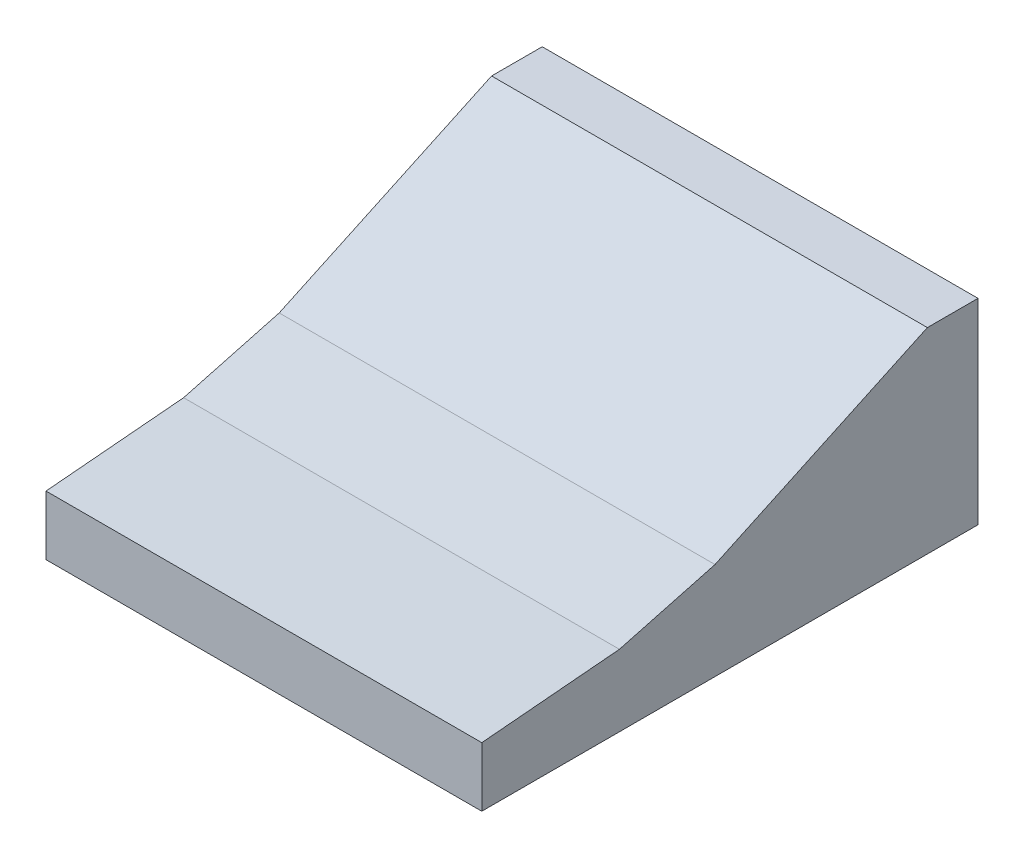
from build123d import *

# Parameters (mm, degrees)
AUFSATZ_LINEAR_AUSTRAGEN1_DEPTH = 440


with BuildPart() as part:
    # Skizze1 → Aufsatz-Linear austragen1 (new body)
    with BuildSketch(Plane(origin=(0, 0, 0), x_dir=(0, 0, -1), z_dir=(1, 0, 0))):
        Polygon((138.961378968, 72.157545328), (235.457769952, 98.013675364), (449.87913509, 198), (501, 198), (501, 0), (0, 0), (0, 60), align=None)
    extrude(amount=AUFSATZ_LINEAR_AUSTRAGEN1_DEPTH)


solid = part.part
